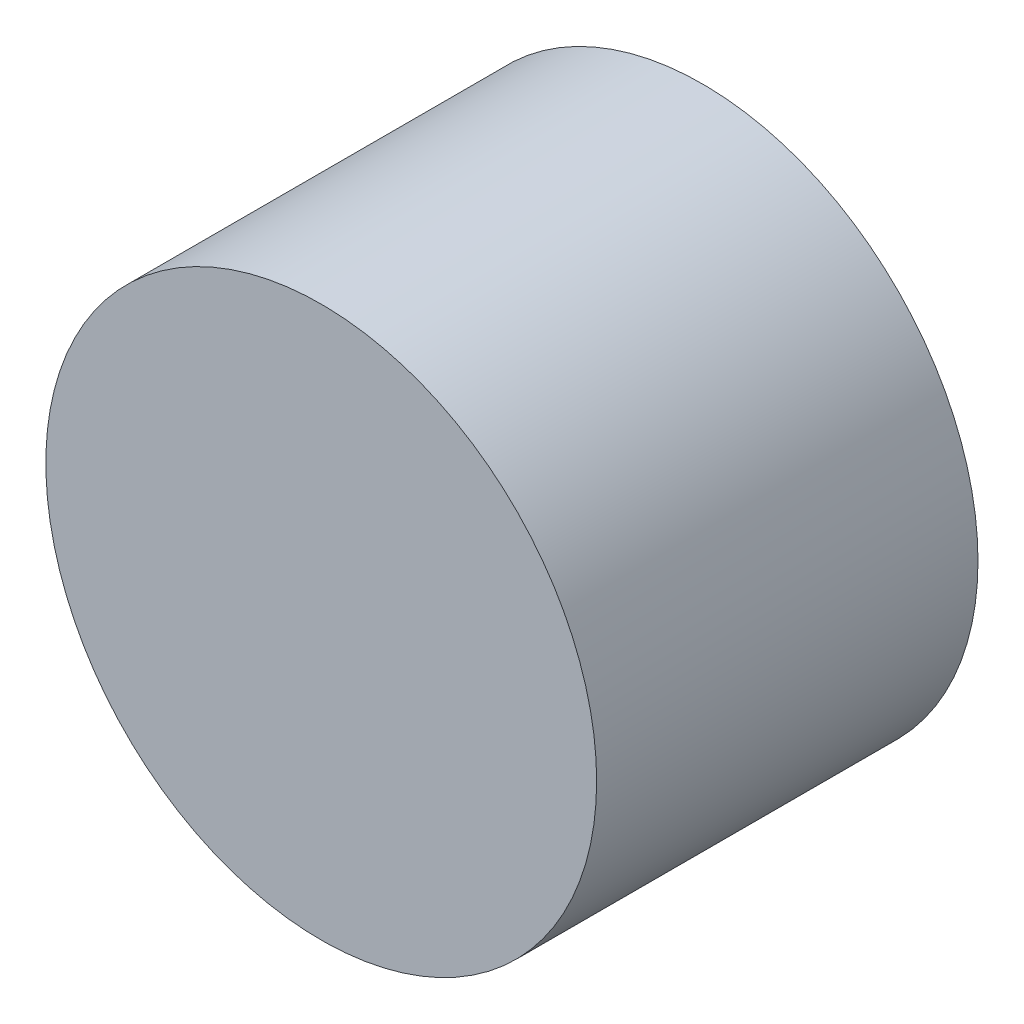
from build123d import *

# Parameters (mm, degrees)
ESQUISSE1_R        = 6.5
BOSS_EXTRU_1_DEPTH = 9


with BuildPart() as part:
    # Esquisse1 → Boss.-Extru.1 (new body)
    with BuildSketch(Plane.XY):
        Circle(ESQUISSE1_R)
    extrude(amount=BOSS_EXTRU_1_DEPTH)


solid = part.part
